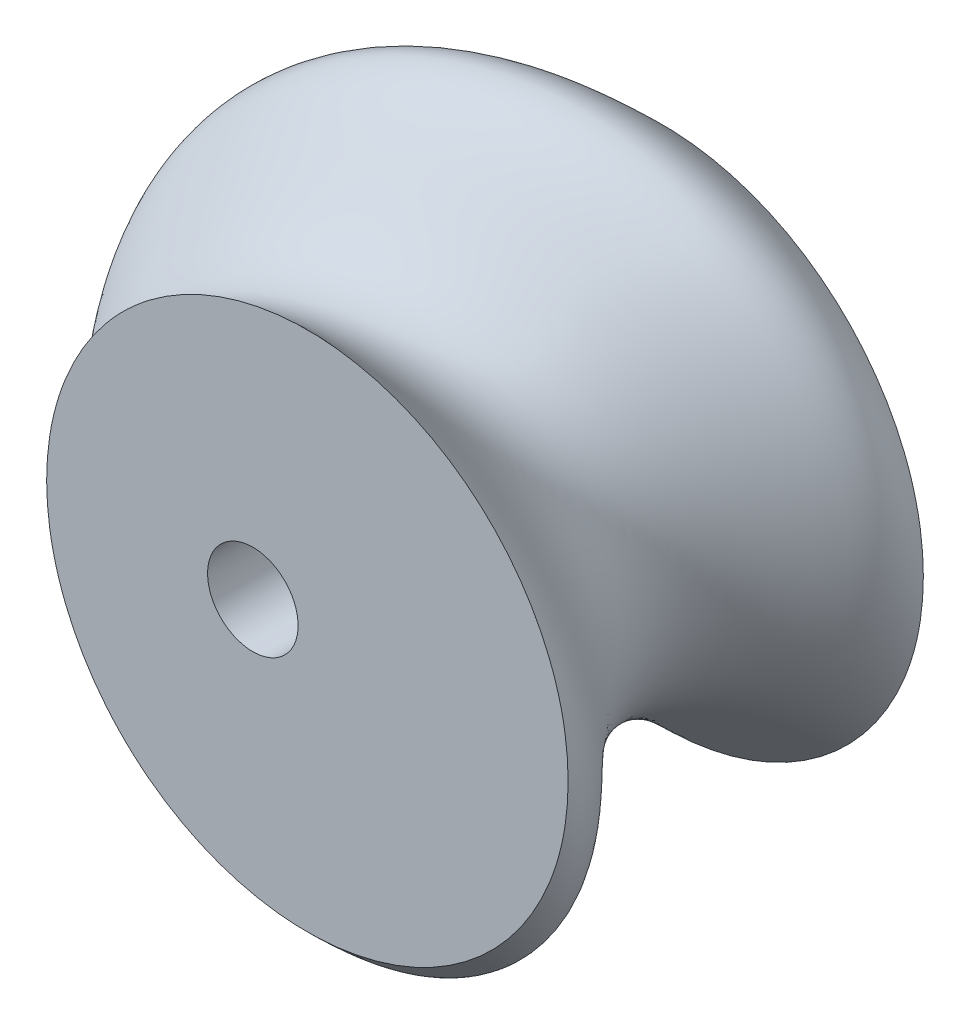
from build123d import *

# Parameters (mm, degrees)
AUSTRAGUNG1_PITCH               = 20
AUSTRAGUNG1_HEIGHT              = 20
AUSTRAGUNG1_RADIUS              = 2.55
SKIZZE2_R                       = 14.681
SKIZZE3_2_R                     = 2.55
SCHNITT_LINEAR_AUSTRAGEN2_DEPTH = 27


with BuildPart() as part:
    # Austragung1: sweep along a helix
    with BuildLine() as austragung1_path:
        Helix(AUSTRAGUNG1_PITCH, AUSTRAGUNG1_HEIGHT, AUSTRAGUNG1_RADIUS, center=(-3.071, 0, 0), direction=(0, 0, 1))
    # Skizze2 → Austragung1 (sweep)
    with BuildSketch(Plane.XY):
        Circle(SKIZZE2_R)
    sweep(path=austragung1_path.line, is_frenet=True)

    # Skizze3<2> → Schnitt-Linear austragen2 (cut)
    with BuildSketch(Plane.XY):
        with Locations(Location((-3.071, 0, 0), (0, 0, 180))):
            Circle(SKIZZE3_2_R)
    extrude(amount=SCHNITT_LINEAR_AUSTRAGEN2_DEPTH, mode=Mode.SUBTRACT)


solid = part.part
